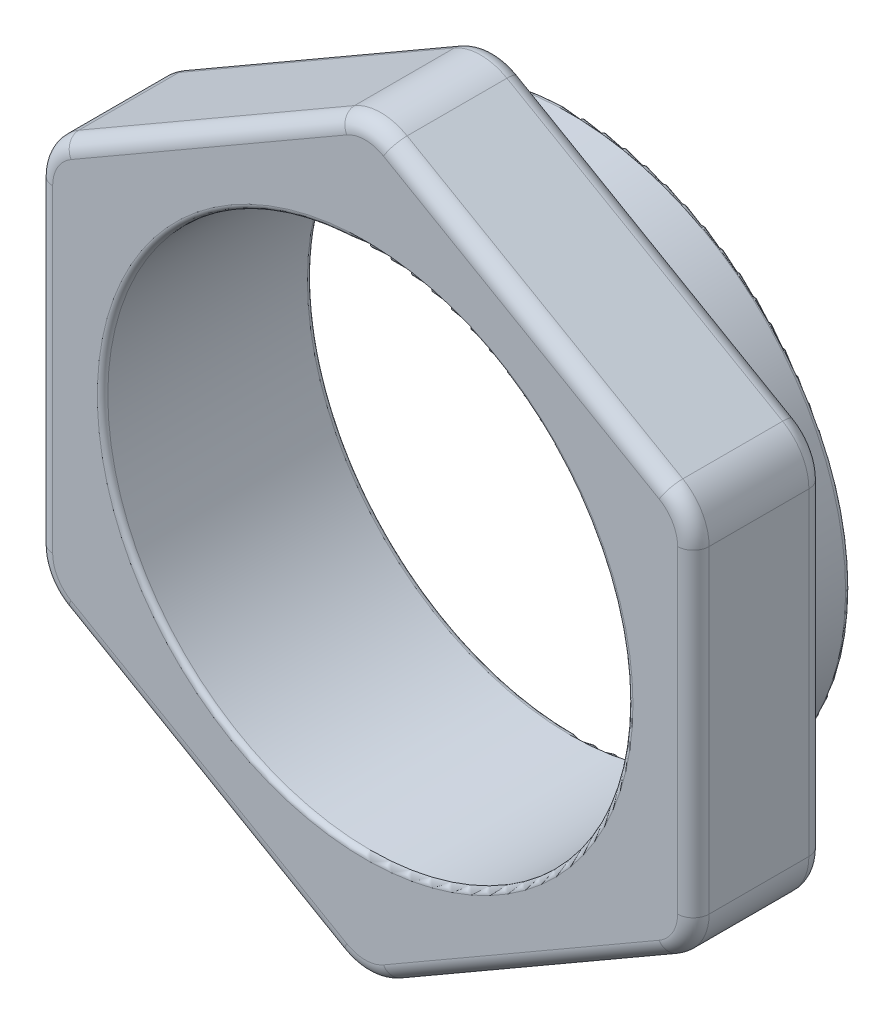
from build123d import *

# Parameters (mm, degrees)
SKETCH1_R           = 6.6675
BOSS_EXTRUDE1_DEPTH = 1.905
BOSS_EXTRUDE2_DEPTH = 3.175
SKETCH3_R           = 6.35
CUT_EXTRUDE1_DEPTH  = 14.145931484
FILLET1_R           = 1.27
FILLET2_R           = 0.381
FILLET3_R           = 0.127


with BuildPart() as part:
    # Sketch1 → Boss-Extrude1 (new body)
    with BuildSketch(Plane.XY):
        with Locations(Location((0, 0, 0), (0, 0, 180))):
            Circle(SKETCH1_R)
    extrude(amount=BOSS_EXTRUDE1_DEPTH)

    # Sketch2 → Boss-Extrude2 (add)
    with BuildSketch(Plane.XY.offset(1.905)):
        Polygon((7.9375, 4.582717762), (0, 9.165435523), (-7.9375, 4.582717762), (-7.9375, -4.582717762), (0, -9.165435523), (7.9375, -4.582717762), align=None)
    extrude(amount=BOSS_EXTRUDE2_DEPTH)

    # Sketch3 → Cut-Extrude1 (cut, through all)
    with BuildSketch(Plane(origin=(0, 0, 0), x_dir=(-1, 0, 0), z_dir=(0, 0, -1))):
        Circle(SKETCH3_R)
    extrude(amount=-CUT_EXTRUDE1_DEPTH, mode=Mode.SUBTRACT)

    # Fillet1
    fillet1_edges = [part.edges().sort_by_distance(p)[0] for p in [
        (7.9375, -4.582717762, 3.4925),
        (7.9375, 4.582717762, 3.4925),
        (0, 9.165435523, 3.4925),
        (-7.9375, 4.582717762, 3.4925),
        (-7.9375, -4.582717762, 3.4925),
        (0, -9.165435523, 3.4925),
    ]]
    fillet(fillet1_edges, radius=FILLET1_R)

    # Fillet2
    fillet2_edges = [part.edges().sort_by_distance(p)[0] for p in [
        (7.9375, 0, 1.905),
        (7.9375, 0, 5.08),
        (3.96875, -6.874076643, 1.905),
        (-3.96875, -6.874076643, 1.905),
        (-7.9375, 0, 1.905),
        (-3.96875, 6.874076643, 1.905),
        (3.96875, 6.874076643, 1.905),
        (0, 8.96896584, 1.905),
        (7.767352263, 4.48448292, 1.905),
        (-7.767352263, 4.48448292, 1.905),
        (-7.767352263, -4.48448292, 1.905),
        (0, -8.96896584, 1.905),
        (7.767352263, -4.48448292, 1.905),
        (3.96875, -6.874076643, 5.08),
        (3.96875, 6.874076643, 5.08),
        (-3.96875, 6.874076643, 5.08),
        (-7.9375, 0, 5.08),
        (-3.96875, -6.874076643, 5.08),
        (0, 8.96896584, 5.08),
        (7.767352263, 4.48448292, 5.08),
        (-7.767352263, 4.48448292, 5.08),
        (-7.767352263, -4.48448292, 5.08),
        (0, -8.96896584, 5.08),
        (7.767352263, -4.48448292, 5.08),
    ]]
    fillet(fillet2_edges, radius=FILLET2_R)

    # Fillet3
    fillet3_edges = [part.edges().sort_by_distance(p)[0] for p in [
        (6.6675, 0, 0),
        (6.35, 0, 5.08),
        (6.35, 0, 0),
        (6.6675, 0, 1.905),
    ]]
    fillet(fillet3_edges, radius=FILLET3_R)


solid = part.part
